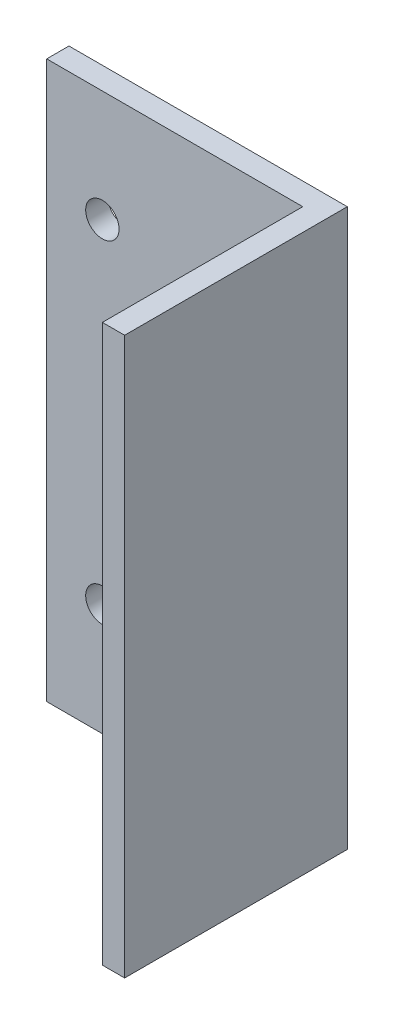
from build123d import *

# Parameters (mm, degrees)
BOSS_EXTRUDE1_DEPTH = 50
SKETCH2_R           = 1.5
CUT_EXTRUDE1_DEPTH  = 60.371710435


with BuildPart() as part:
    # Sketch1 → Boss-Extrude1 (new body)
    with BuildSketch(Plane(origin=(0, 0, 0), x_dir=(1, 0, 0), z_dir=(0, 1, 0))):
        Polygon((0, 0), (25, 0), (25, -20), (23, -20), (23, -2), (0, -2), align=None)
    extrude(amount=BOSS_EXTRUDE1_DEPTH)

    # Sketch2 → Cut-Extrude1 (cut, through all)
    with BuildSketch(Plane(origin=(0, 0, 0), x_dir=(-1, 0, 0), z_dir=(0, 0, -1))):
        with Locations((-5, 40)):
            Circle(SKETCH2_R)
        with Locations((-5, 10)):
            Circle(SKETCH2_R)
    extrude(amount=-CUT_EXTRUDE1_DEPTH, mode=Mode.SUBTRACT)


solid = part.part
